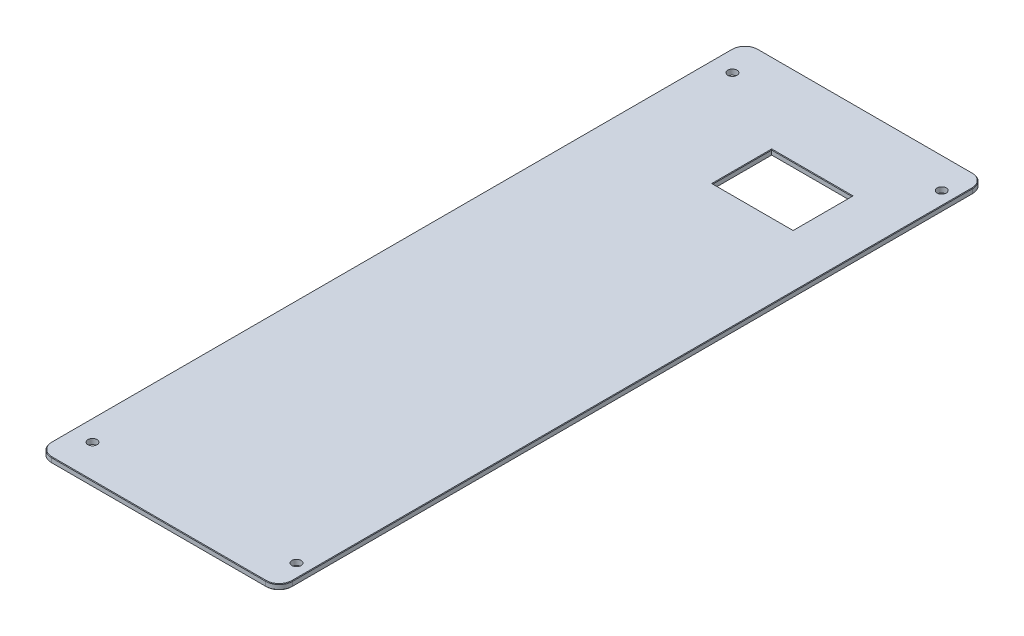
from build123d import *

# Parameters (mm, degrees)
ESQUISSE1_W             = 90
ESQUISSE1_H             = 2
BASE_EXTRUSION_DEPTH    = 264
ESQUISSE2_W             = 30
ESQUISSE2_H             = 22
ENL_V_MAT_EXTRU_1_DEPTH = 279.92651362
CONG_1_R                = 5
CHANFREIN1_SIZE         = 0.2
ESQUISSE3_R             = 1.7
ENL_V_MAT_EXTRU_2_DEPTH = 279.92651362


with BuildPart() as part:
    # Esquisse1 → Base-Extrusion (new body)
    with BuildSketch(Plane.XY):
        with Locations((45, 1)):
            Rectangle(ESQUISSE1_W, ESQUISSE1_H)
    extrude(amount=BASE_EXTRUSION_DEPTH)

    # Esquisse2 → Enlèv. mat.-Extru.1 (cut, through all)
    with BuildSketch(Plane(origin=(0, 2, 0), x_dir=(-1, 0, 0), z_dir=(0, 1, 0))):
        with Locations((-55, 41)):
            Rectangle(ESQUISSE2_W, ESQUISSE2_H)
    extrude(amount=-ENL_V_MAT_EXTRU_1_DEPTH, mode=Mode.SUBTRACT)

    # Congé1
    cong_1_edges = [part.edges().sort_by_distance(p)[0] for p in [
        (0, 1, 0),
        (0, 1, 264),
        (90, 1, 0),
        (90, 1, 264),
    ]]
    fillet(cong_1_edges, radius=CONG_1_R)

    # Chanfrein1
    chanfrein1_edges = [part.edges().sort_by_distance(p)[0] for p in [
        (0, 0, 132),
        (1.464466094, 0, 1.464466094),
        (1.464466094, 0, 262.535533906),
        (45, 0, 0),
        (45, 0, 264),
        (88.535533906, 0, 1.464466094),
        (88.535533906, 0, 262.535533906),
        (90, 0, 132),
        (70, 0, 41),
        (55, 0, 30),
        (40, 0, 41),
        (55, 0, 52),
        (0, 2, 132),
        (1.464466094, 2, 1.464466094),
        (1.464466094, 2, 262.535533906),
        (45, 2, 0),
        (45, 2, 264),
        (88.535533906, 2, 1.464466094),
        (88.535533906, 2, 262.535533906),
        (90, 2, 132),
        (70, 2, 41),
        (55, 2, 30),
        (40, 2, 41),
        (55, 2, 52),
    ]]
    chamfer(chanfrein1_edges, length=CHANFREIN1_SIZE)

    # Esquisse3 → Enlèv. mat.-Extru.2 (cut, through all)
    with BuildSketch(Plane(origin=(0, 2, 0), x_dir=(-1, 0, 0), z_dir=(0, 1, 0))):
        with Locations((-7.82, 251.51)):
            Circle(ESQUISSE3_R)
        with Locations((-7.82, 12.49)):
            Circle(ESQUISSE3_R)
        with Locations((-85, 252.5)):
            Circle(ESQUISSE3_R)
        with Locations((-85, 11.5)):
            Circle(ESQUISSE3_R)
    extrude(amount=-ENL_V_MAT_EXTRU_2_DEPTH, mode=Mode.SUBTRACT)


solid = part.part
